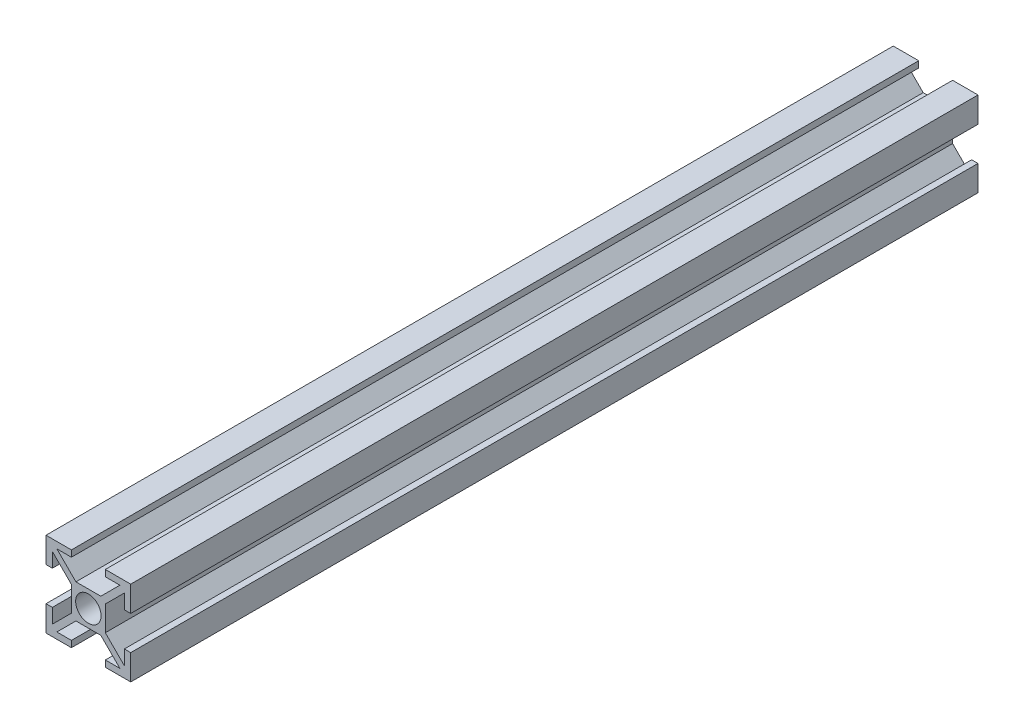
from build123d import *

# Parameters (mm, degrees)
ESBO_O1_R                = 3
RESSALTO_EXTRUS_O1_DEPTH = 200


with BuildPart() as part:
    # Esboço1 → Ressalto-extrusão1 (new body)
    with BuildSketch(Plane.XY):
        Polygon((-2.939339828, 4), (2.939339828, 4), (7.439339828, 8.5), (4, 8.5), (4, 10), (10, 10), (10, 4), (8.5, 4), (8.5, 7.439339828), (4, 2.939339828), (4, -2.939339828), (8.5, -7.439339828), (8.5, -4), (10, -4), (10, -10), (4, -10), (4, -8.5), (7.439339828, -8.5), (2.939339828, -4), (-2.939339828, -4), (-7.439339828, -8.5), (-4, -8.5), (-4, -10), (-10, -10), (-10, -4), (-8.5, -4), (-8.5, -7.439339828), (-4, -2.939339828), (-4, 2.939339828), (-8.5, 7.439339828), (-8.5, 4), (-10, 4), (-10, 10), (-4, 10), (-4, 8.5), (-7.439339828, 8.5), align=None)
        Circle(ESBO_O1_R, mode=Mode.SUBTRACT)
    extrude(amount=RESSALTO_EXTRUS_O1_DEPTH)


solid = part.part
